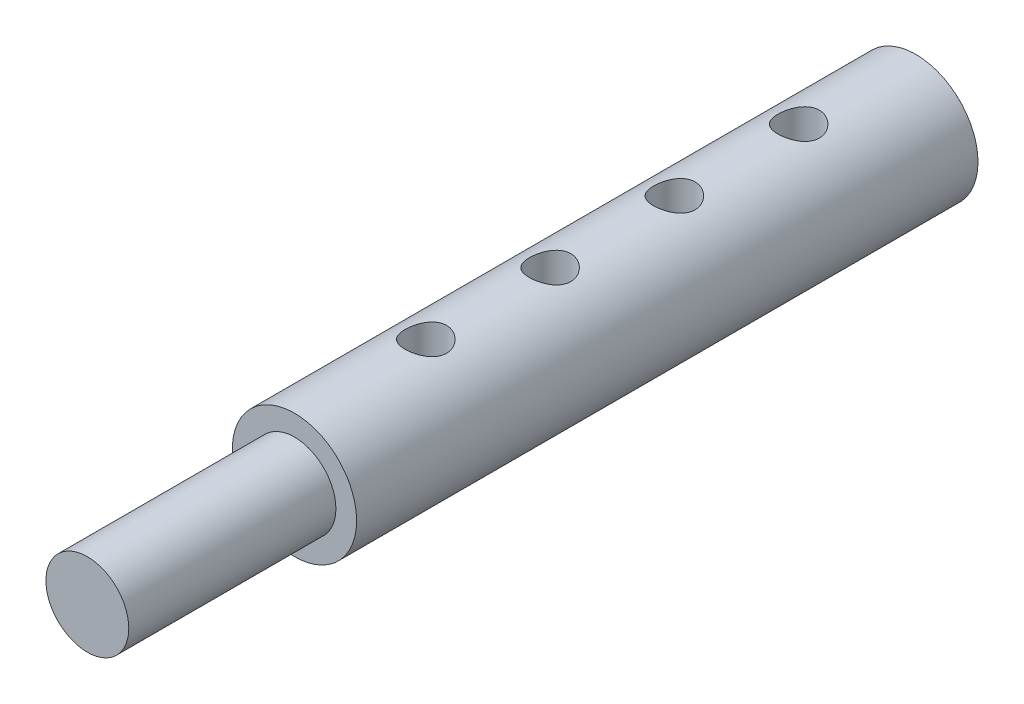
from build123d import *

# Parameters (mm, degrees)
SZKIC1_R                        = 15
DODANIE_WYCI_GNI_CIE1_DEPTH     = 150
SZKIC2_R                        = 10
DODANIE_WYCI_GNI_CIE2_DEPTH     = 50
WYTNIJ_WYCI_GNI_CIE1_DEPTH      = 70
WYTNIJ_WYCI_GNI_CIE1_DEPTH_BACK = 70
SZKIC3_R                        = 5


with BuildPart() as part:
    # Szkic1 → Dodanie-wyciągnięcie1 (new body)
    with BuildSketch(Plane.XY):
        Circle(SZKIC1_R)
    extrude(amount=DODANIE_WYCI_GNI_CIE1_DEPTH)

    # Szkic2 → Dodanie-wyciągnięcie2 (add)
    with BuildSketch(Plane.XY.offset(150)):
        Circle(SZKIC2_R)
    extrude(amount=DODANIE_WYCI_GNI_CIE2_DEPTH)

    # Szkic3 → Wytnij-wyciągnięcie1 (cut, two sides: drawn at the far end of the back side and taken through both)
    with BuildSketch(Plane(origin=(0, 0, 0), x_dir=(1, 0, 0), z_dir=(0, 1, 0)).offset(-WYTNIJ_WYCI_GNI_CIE1_DEPTH_BACK)):
        with Locations((0, -28.303646962)):
            Circle(SZKIC3_R)
        with Locations((0, -58.303646962)):
            Circle(SZKIC3_R)
        with Locations((0, -88.303646962)):
            Circle(SZKIC3_R)
        with Locations((0, -118.303646962)):
            Circle(SZKIC3_R)
    extrude(amount=WYTNIJ_WYCI_GNI_CIE1_DEPTH + WYTNIJ_WYCI_GNI_CIE1_DEPTH_BACK, mode=Mode.SUBTRACT)


solid = part.part
